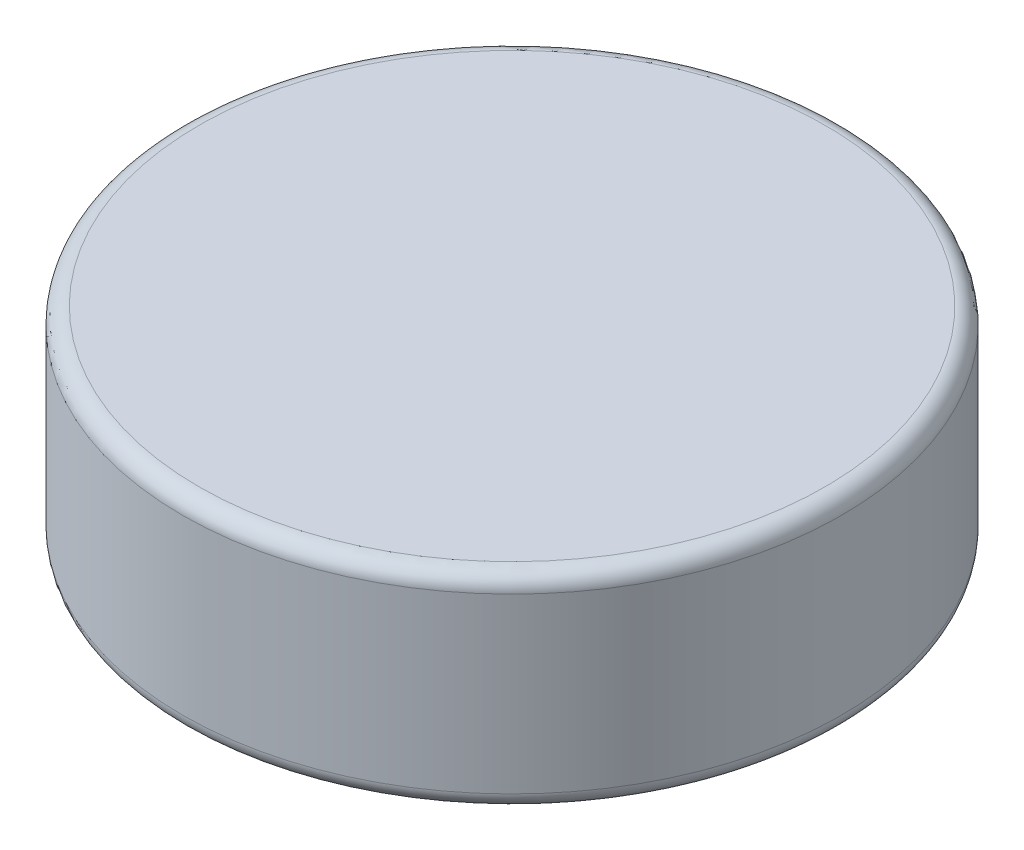
from build123d import *

# Parameters (mm, degrees)
SKETCH1_R           = 4
BOSS_EXTRUDE1_DEPTH = 2.5
FILLET1_R           = 0.2


with BuildPart() as part:
    # Sketch1 → Boss-Extrude1 (new body)
    with BuildSketch(Plane(origin=(0, 0, 0), x_dir=(1, 0, 0), z_dir=(0, 1, 0))):
        with Locations(Location((0, 0, 0), (0, 0, 270))):
            Circle(SKETCH1_R)
    extrude(amount=BOSS_EXTRUDE1_DEPTH)

    # Fillet1
    fillet1_edges = [part.edges().sort_by_distance(p)[0] for p in [
        (0, 0, -4),
        (0, 2.5, -4),
    ]]
    fillet(fillet1_edges, radius=FILLET1_R)


solid = part.part
